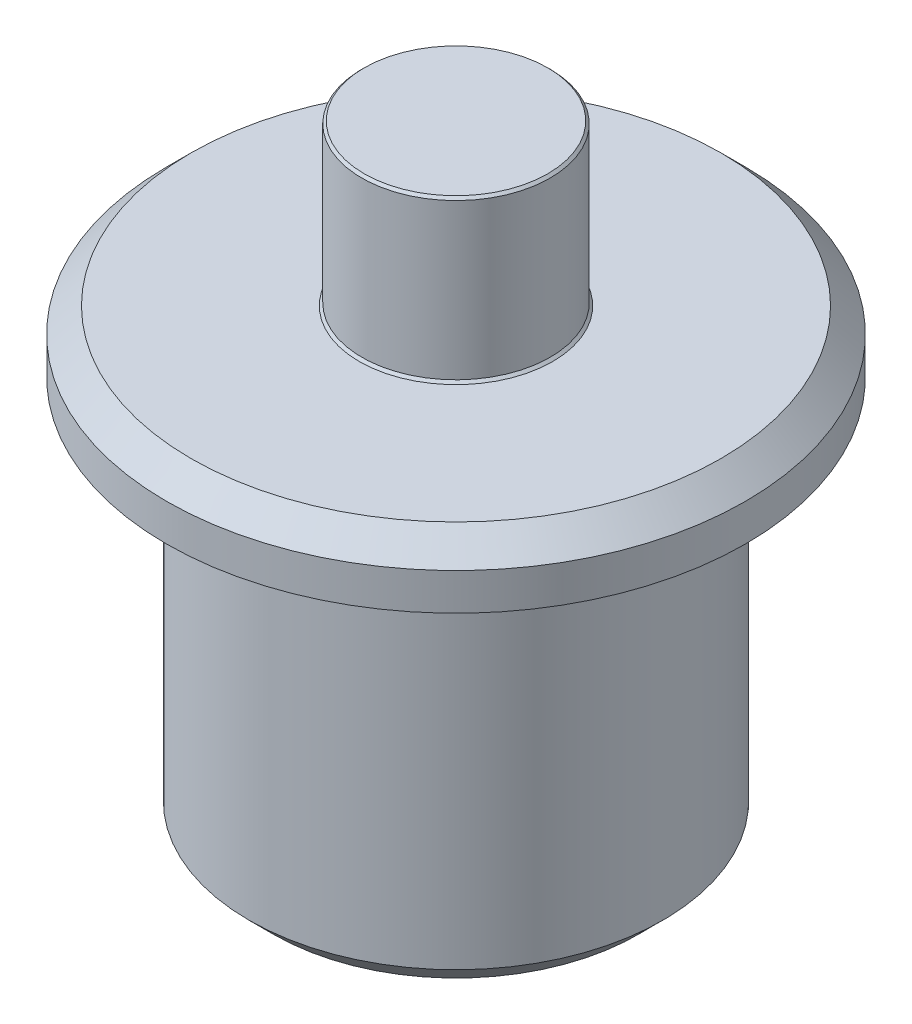
from build123d import *

# Parameters (mm, degrees)
SKETCH_1_R      = 8.4
EXTRUDE_1_DEPTH = 15.9
SKETCH_2_R      = 11.75
EXTRUDE_2_DEPTH = 2.5
SKETCH_3_R      = 3.825
EXTRUDE_3_DEPTH = 6.5
CHAMFER_1_SIZE  = 1
CHAMFER_2_SIZE  = 0.1


with BuildPart() as part:
    # Эскиз1 → Бобышка-Вытянуть1 (new body)
    with BuildSketch(Plane(origin=(0, 0, 0), x_dir=(1, 0, 0), z_dir=(0, 1, 0))):
        with Locations(Location((0, 0, 0), (0, 0, 270))):
            Circle(SKETCH_1_R)
    extrude(amount=EXTRUDE_1_DEPTH)

    # Эскиз2 → Бобышка-Вытянуть2 (add)
    with BuildSketch(Plane(origin=(0, 15.9, 0), x_dir=(1, 0, 0), z_dir=(0, 1, 0))):
        with Locations(Location((0, 0, 0), (0, 0, 270))):
            Circle(SKETCH_2_R)
    extrude(amount=EXTRUDE_2_DEPTH)

    # Эскиз3 → Бобышка-Вытянуть3 (add)
    with BuildSketch(Plane(origin=(0, 18.4, 0), x_dir=(1, 0, 0), z_dir=(0, 1, 0))):
        with Locations(Location((0, 0, 0), (0, 0, 90))):
            Circle(SKETCH_3_R)
    extrude(amount=EXTRUDE_3_DEPTH)

    # Фаска1
    chamfer_1_edges = [part.edges().sort_by_distance(p)[0] for p in [
        (0, 0, -8.4),
        (0, 18.4, -11.75),
    ]]
    chamfer(chamfer_1_edges, length=CHAMFER_1_SIZE)

    # Фаска2
    chamfer_2_edges = [part.edges().sort_by_distance(p)[0] for p in [
        (0, 24.9, 3.825),
        (0, 18.4, 3.825),
    ]]
    chamfer(chamfer_2_edges, length=CHAMFER_2_SIZE)


solid = part.part
